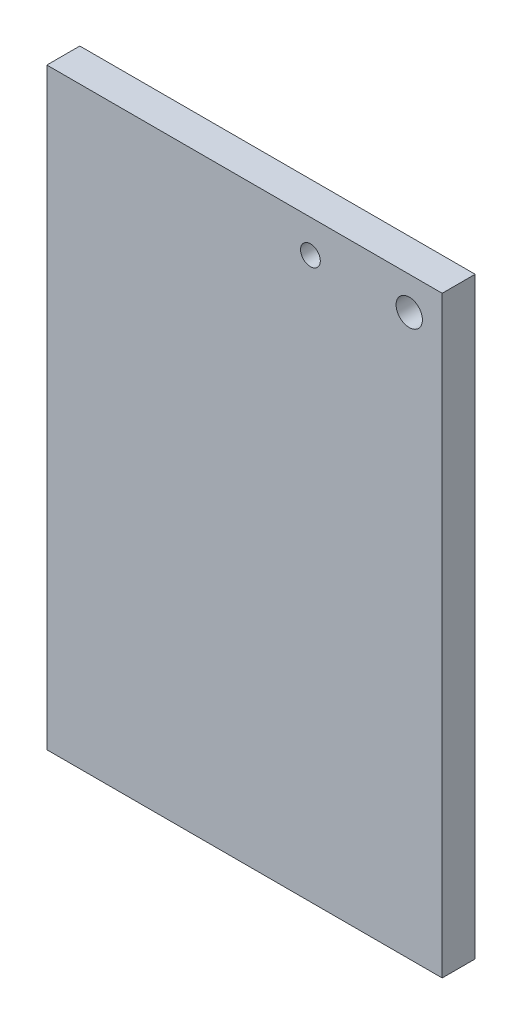
from build123d import *

# Parameters (mm, degrees)
ESQUISSE1_W        = 60
ESQUISSE1_H        = 90
ESQUISSE1_R        = 2
ESQUISSE1_R_2      = 1.5
BOSS_EXTRU_1_DEPTH = 5


with BuildPart() as part:
    # Esquisse1 → Boss.-Extru.1 (new body)
    with BuildSketch(Plane.XY):
        with Locations((30, -45)):
            Rectangle(ESQUISSE1_W, ESQUISSE1_H)
        with Locations((55, -5)):
            Circle(ESQUISSE1_R, mode=Mode.SUBTRACT)
        with Locations((40, -5)):
            Circle(ESQUISSE1_R_2, mode=Mode.SUBTRACT)
    extrude(amount=BOSS_EXTRU_1_DEPTH)


solid = part.part
